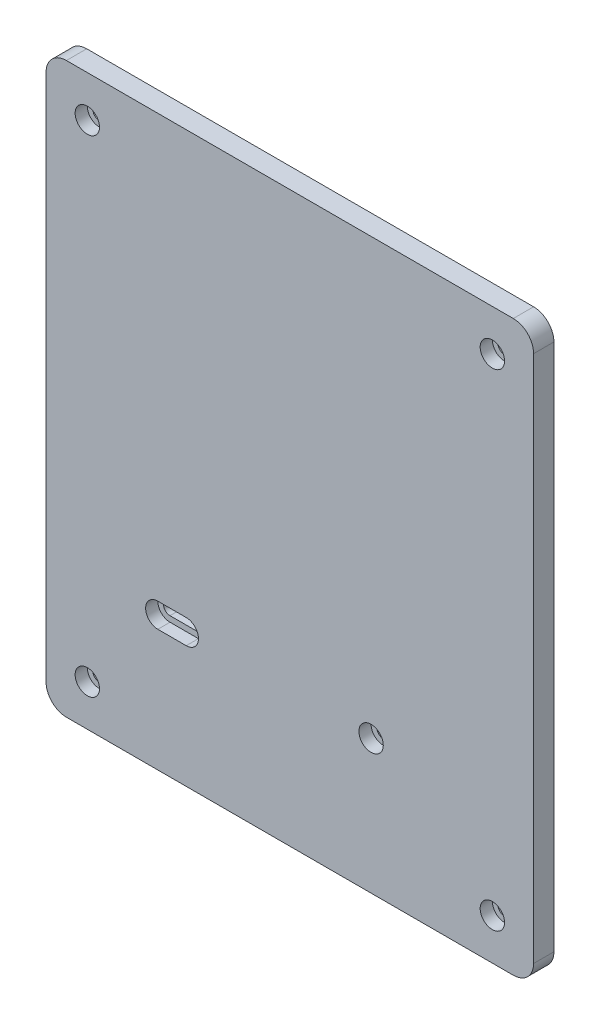
from build123d import *

# Parameters (mm, degrees)
SKETCH1_W           = 120
SKETCH1_H           = 140
SKETCH1_R           = 1.65
BOSS_EXTRUDE1_DEPTH = 5
FILLET3_R           = 5
SKETCH3_R           = 1.6
CUT_EXTRUDE3_DEPTH  = 5
SKETCH2_R           = 3
SKETCH2_R_2         = 1.6
CUT_EXTRUDE1_DEPTH  = 3


with BuildPart() as part:
    # Sketch1 → Boss-Extrude1 (new body)
    with BuildSketch(Plane.XY):
        Rectangle(SKETCH1_W, SKETCH1_H)
        with Locations((-49.85, -59.85)):
            Circle(SKETCH1_R, mode=Mode.SUBTRACT)
        with Locations((49.85, -59.85)):
            Circle(SKETCH1_R, mode=Mode.SUBTRACT)
        with Locations((49.85, 59.85)):
            Circle(SKETCH1_R, mode=Mode.SUBTRACT)
        with Locations((-49.85, 59.85)):
            Circle(SKETCH1_R, mode=Mode.SUBTRACT)
    extrude(amount=BOSS_EXTRUDE1_DEPTH)

    # Fillet3
    fillet3_edges = [part.edges().sort_by_distance(p)[0] for p in [
        (60, -70, 2.5),
        (-60, -70, 2.5),
        (-60, 70, 2.5),
        (60, 70, 2.5),
    ]]
    fillet(fillet3_edges, radius=FILLET3_R)

    # Sketch3 → Cut-Extrude3 (cut)
    with BuildSketch(Plane.XY.offset(5)):
        with Locations((20, -37)):
            Circle(SKETCH3_R)
        with BuildLine():
            Line((-32.5, -35.4), (-25.5, -35.4))
            ThreePointArc((-25.5, -35.4), (-23.9, -37), (-25.5, -38.6))
            Line((-25.5, -38.6), (-32.5, -38.6))
            ThreePointArc((-32.5, -38.6), (-34.1, -37), (-32.5, -35.4))
        make_face()
    extrude(amount=-CUT_EXTRUDE3_DEPTH, mode=Mode.SUBTRACT)

    # Sketch2 → Cut-Extrude1 (cut)
    # profile 1 of 6: a face of its own
    with BuildSketch(Plane.XY.offset(5)):
        with Locations((-49.85, 59.85)):
            Circle(SKETCH2_R)
    # profile 2 of 6: a face of its own
    with BuildSketch(Plane.XY.offset(5)):
        with Locations((49.85, 59.85)):
            Circle(SKETCH2_R)
    # profile 3 of 6: a face of its own
    with BuildSketch(Plane.XY.offset(5)):
        with Locations((49.85, -59.85)):
            Circle(SKETCH2_R)
    # profile 4 of 6: a face of its own
    with BuildSketch(Plane.XY.offset(5)):
        with Locations((-49.85, -59.85)):
            Circle(SKETCH2_R)
    # profile 5 of 6: a face of its own
    with BuildSketch(Plane.XY.offset(5)):
        with Locations((20, -37)):
            Circle(SKETCH2_R)
        with Locations((20, -37)):
            Circle(SKETCH2_R_2, mode=Mode.SUBTRACT)
    # profile 6 of 6: a face of its own
    with BuildSketch(Plane.XY.offset(5)):
        with BuildLine():
            Line((-32.5, -34), (-25.5, -34))
            ThreePointArc((-25.5, -34), (-22.5, -37), (-25.5, -40))
            Line((-25.5, -40), (-32.5, -40))
            ThreePointArc((-32.5, -40), (-35.5, -37), (-32.5, -34))
        make_face()
        with BuildLine():
            Line((-32.5, -35.4), (-25.5, -35.4))
            ThreePointArc((-25.5, -35.4), (-23.9, -37), (-25.5, -38.6))
            Line((-25.5, -38.6), (-32.5, -38.6))
            ThreePointArc((-32.5, -38.6), (-34.1, -37), (-32.5, -35.4))
        make_face(mode=Mode.SUBTRACT)
    extrude(amount=-CUT_EXTRUDE1_DEPTH, mode=Mode.SUBTRACT)


solid = part.part
